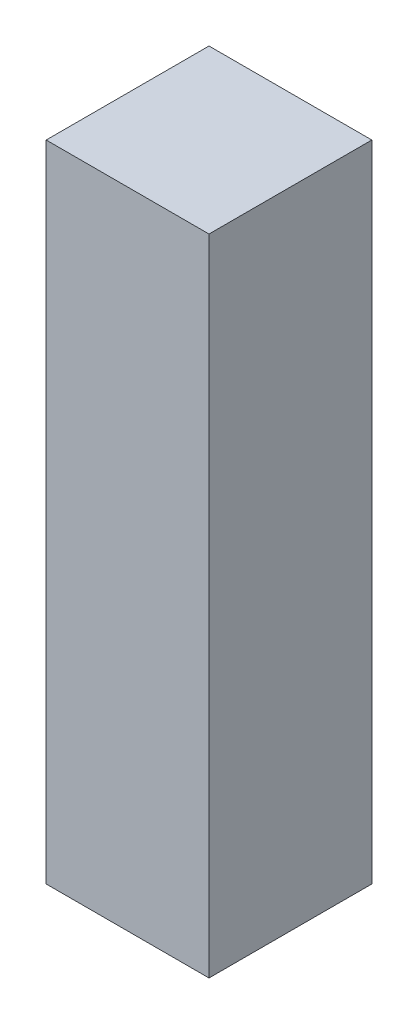
from build123d import *

# Parameters (mm, degrees)
SKETCH1_W           = 300
SKETCH1_H           = 300
BOSS_EXTRUDE1_DEPTH = 1187.25


with BuildPart() as part:
    # Sketch1 → Boss-Extrude1 (new body)
    with BuildSketch(Plane(origin=(0, 0, 0), x_dir=(1, 0, 0), z_dir=(0, 1, 0))):
        Rectangle(SKETCH1_W, SKETCH1_H)
    extrude(amount=BOSS_EXTRUDE1_DEPTH)


solid = part.part
